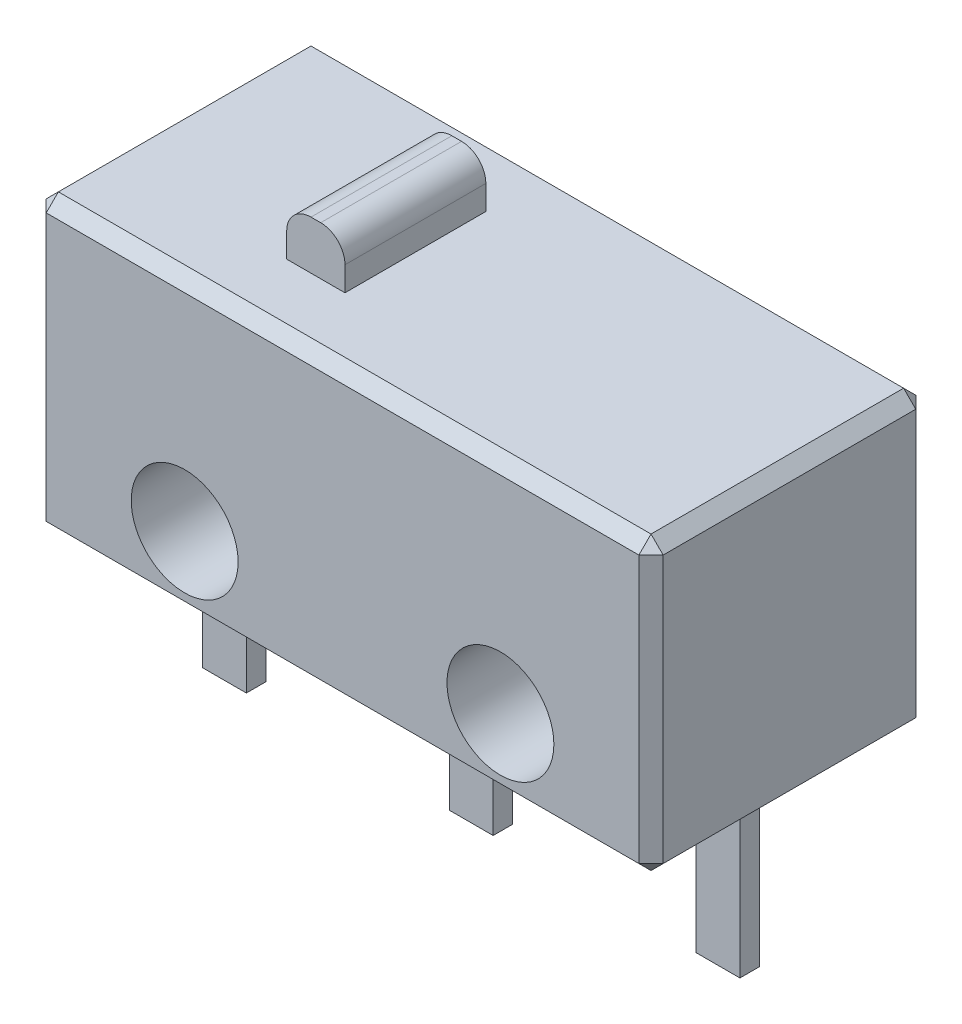
from build123d import *

# Parameters (mm, degrees)
SCHIZZO1_W                   = 12.7
SCHIZZO1_H                   = 6
ESTRUSIONE_ESTRUSIONE1_DEPTH = 5.7
SCHIZZO2_W                   = 1.2
SCHIZZO2_H                   = 2.9
ESTRUSIONE_ESTRUSIONE2_DEPTH = 1
SCHIZZO3_R                   = 1.1
TAGLIO_ESTRUSIONE1_DEPTH     = 10.424038412
RACCORDO1_R                  = 0.5
SCHIZZO4_W                   = 0.9
SCHIZZO4_H                   = 0.4
ESTRUSIONE_ESTRUSIONE3_DEPTH = 3.4
RIPETIZIONE_A_L1_COUNT       = 2
RIPETIZIONE_A_L1_PITCH       = 5.08
RIPETIZIONE_A_L1_COL_COUNT   = 2
RIPETIZIONE_A_L1_COL_PITCH   = 5.08
SMUSSO1_SIZE                 = 0.25


with BuildPart() as part:
    # Schizzo1 → Estrusione-Estrusione1 (new body)
    with BuildSketch(Plane.XY):
        Rectangle(SCHIZZO1_W, SCHIZZO1_H)
    extrude(amount=ESTRUSIONE_ESTRUSIONE1_DEPTH)

    # Schizzo2 → Estrusione-Estrusione2 (add)
    with BuildSketch(Plane(origin=(0, 3, 0), x_dir=(1, 0, 0), z_dir=(0, 1, 0))):
        with Locations((-1.95, -2.85)):
            Rectangle(SCHIZZO2_W, SCHIZZO2_H)
    extrude(amount=ESTRUSIONE_ESTRUSIONE2_DEPTH)

    # Schizzo3 → Taglio-Estrusione1 (cut, through all)
    with BuildSketch(Plane.XY.offset(5.7)):
        with Locations((-3.25, -1.5)):
            Circle(SCHIZZO3_R)
        with Locations((3.25, -1.5)):
            Circle(SCHIZZO3_R)
    extrude(amount=-TAGLIO_ESTRUSIONE1_DEPTH, mode=Mode.SUBTRACT)

    # Raccordo1
    raccordo1_edges = [part.edges().sort_by_distance(p)[0] for p in [
        (-1.35, 4, 2.85),
        (-2.55, 4, 2.85),
    ]]
    fillet(raccordo1_edges, radius=RACCORDO1_R)

    # Schizzo4 → Estrusione-Estrusione3 (add)
    with BuildSketch(Plane.XZ.offset(3)):
        with Locations((0, 2.85)):
            Rectangle(SCHIZZO4_W, SCHIZZO4_H)
    estrusione_estrusione3 = extrude(amount=ESTRUSIONE_ESTRUSIONE3_DEPTH)

    # Ripetizione a L1: Estrusione-Estrusione3 ×2
    with Locations(*[(i * RIPETIZIONE_A_L1_PITCH, 0, 0) for i in range(1, RIPETIZIONE_A_L1_COUNT)]):
        add(estrusione_estrusione3)

    # Ripetizione a L1 col: Estrusione-Estrusione3 ×2
    with Locations(*[(-i * RIPETIZIONE_A_L1_COL_PITCH, 0, 0) for i in range(1, RIPETIZIONE_A_L1_COL_COUNT)]):
        add(estrusione_estrusione3)

    # Smusso1
    smusso1_edges = [part.edges().sort_by_distance(p)[0] for p in [
        (-6.35, 0, 5.7),
        (0, -3, 5.7),
        (6.35, 0, 5.7),
        (0, -3, 0),
        (0.45, -3, 2.85),
        (0, -3, 3.05),
        (-0.45, -3, 2.85),
        (0, -3, 2.65),
        (-6.35, 0, 0),
        (0, 3, 0),
        (6.35, 0, 0),
        (5.53, -3, 2.85),
        (5.08, -3, 3.05),
        (4.63, -3, 2.85),
        (5.08, -3, 2.65),
        (-4.63, -3, 2.85),
        (-5.08, -3, 3.05),
        (-5.53, -3, 2.85),
        (-5.08, -3, 2.65),
        (6.35, -3, 2.85),
        (-6.35, -3, 2.85),
        (-6.35, 3, 2.85),
        (6.35, 3, 2.85),
        (0, 3, 5.7),
    ]]
    chamfer(smusso1_edges, length=SMUSSO1_SIZE)


solid = part.part
